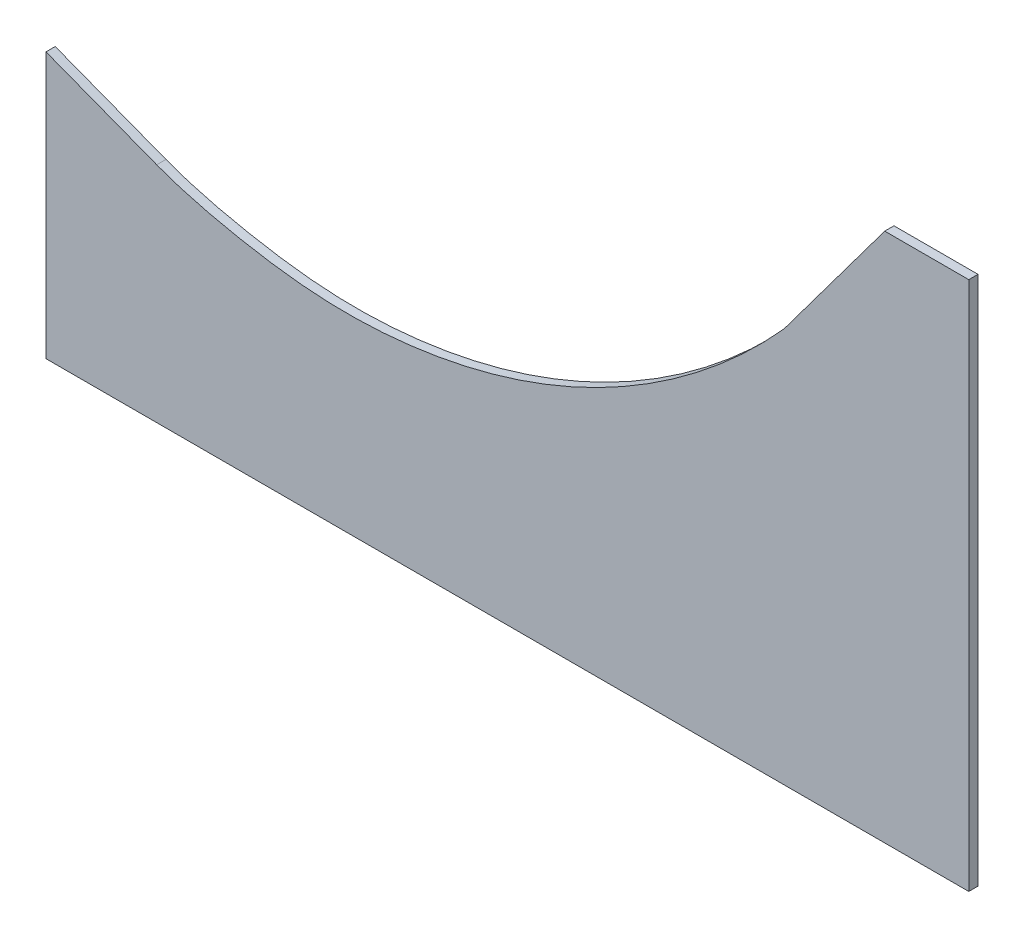
from build123d import *

# Parameters (mm, degrees)
P_IDAT_VYSUNUT_M1_DEPTH = 1


with BuildPart() as part:
    # Skica1 → Přidat vysunutím1 (new body)
    with BuildSketch(Plane.XY):
        with BuildLine():
            Line((-18, 24.202745422), (-30, 28.799160271))
            Line((-30, 28.799160271), (-30, 0))
            Line((-30, 0), (70, 0))
            Line((70, 0), (70, 57.421257865))
            Line((70, 57.421257865), (60.893124688, 57.421257865))
            Line((60.893124688, 57.421257865), (50, 42.815530581))
            add(Edge.make_bspline(
                [(-18, 24.202745422), (-15.420987086, 23.214894317), (-9.439226577, 21.709441745), (-0.04984208, 20.304879655), (10.115235915, 20.781402631), (20.26700575, 22.994551549), (34.677773963, 28.876632867), (44.35056656, 36.49037351), (50, 42.815530581)],
                knots=[0, 0, 0, 0, 0.110930708, 0.245725485, 0.379434234, 0.516153574, 0.660347153, 1, 1, 1, 1], degree=3))
        make_face()
    extrude(amount=P_IDAT_VYSUNUT_M1_DEPTH)


solid = part.part
